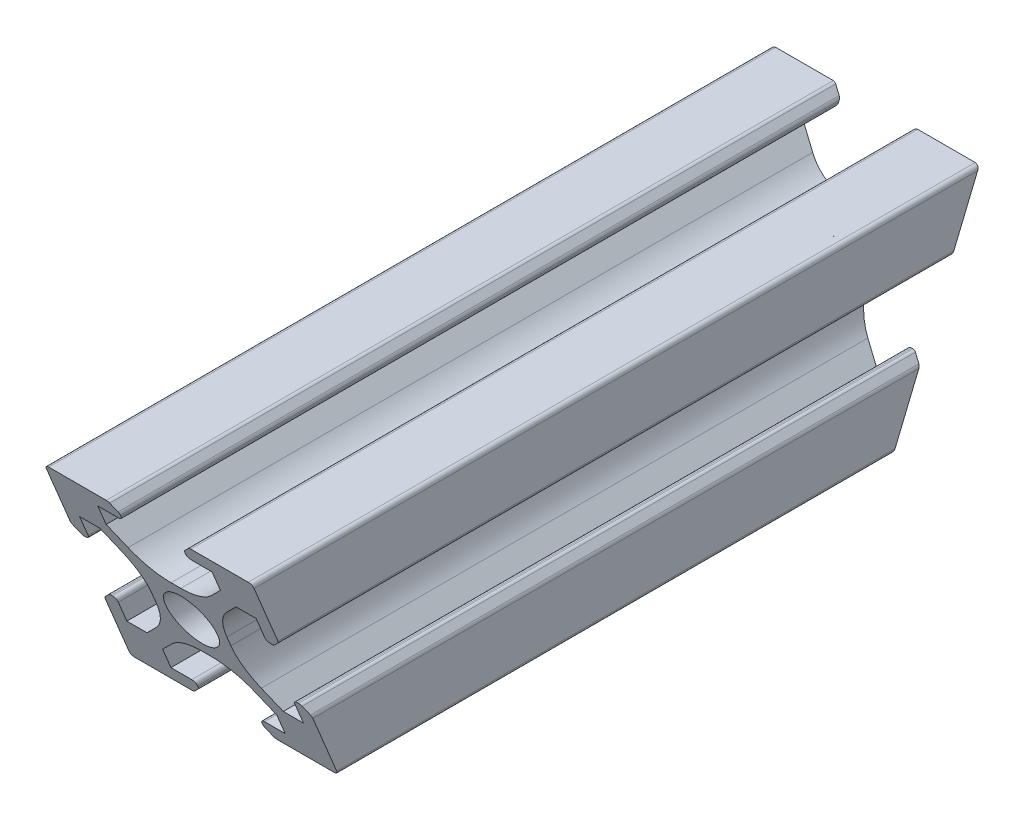
from build123d import *

# Parameters (mm, degrees)
RESSALTO_EXTRUS_O1_DEPTH = 70
PADR_OCIRCULAR1_COUNT    = 4
FILETE1_R                = 0.4
CUT_EXTRUDE1_DEPTH       = 74.484692283
SKETCH2_R                = 1.5
CUT_EXTRUDE2_DEPTH       = 74.484692283


with BuildPart() as part:
    # Esboço1 → Ressalto-extrusão1 (new body)
    with BuildSketch(Plane.XY):
        with BuildLine():
            ThreePointArc((-9.317157288, 3.217157288), (-9.187387948, 3.130448187), (-9.034314575, 3.1))
            Line((-9.034314575, 3.1), (-8.9, 3.1))
            ThreePointArc((-8.9, 3.1), (-8.617157288, 3.217157288), (-8.5, 3.5))
            Line((-8.5, 3.5), (-8.5, 5.5))
            Line((-8.5, 5.5), (-6.560660172, 5.5))
            Line((-6.560660172, 5.5), (-5.064466094, 4.003805922))
            ThreePointArc((-5.064466094, 4.003805922), (-3.980602337, 2.381689178), (-3.6, 0.468272016))
            Line((-3.6, 0.468272016), (-3.6, 0))
            Line((-3.6, 0), (-2.5, 0))
            ThreePointArc((-2.5, 0), (-1.767766953, 1.767766953), (0, 2.5))
            Line((0, 2.5), (0, 3.6))
            Line((0, 3.6), (-0.468272016, 3.6))
            ThreePointArc((-0.468272016, 3.6), (-2.381689178, 3.980602337), (-4.003805922, 5.064466094))
            Line((-4.003805922, 5.064466094), (-5.5, 6.560660172))
            Line((-5.5, 6.560660172), (-5.5, 8.5))
            Line((-5.5, 8.5), (-3.5, 8.5))
            ThreePointArc((-3.5, 8.5), (-3.217157288, 8.617157288), (-3.1, 8.9))
            Line((-3.1, 8.9), (-3.1, 9.034314575))
            ThreePointArc((-3.1, 9.034314575), (-3.130448187, 9.187387948), (-3.217157288, 9.317157288))
            Line((-3.217157288, 9.317157288), (-3.782842712, 9.882842712))
            ThreePointArc((-3.782842712, 9.882842712), (-3.912612052, 9.969551813), (-4.065685425, 10))
            Line((-4.065685425, 10), (-10, 10))
            Line((-10, 10), (-10, 4.065685425))
            ThreePointArc((-10, 4.065685425), (-9.969551813, 3.912612052), (-9.882842712, 3.782842712))
            Line((-9.882842712, 3.782842712), (-9.317157288, 3.217157288))
        make_face()
    ressalto_extrus_o1 = extrude(amount=RESSALTO_EXTRUS_O1_DEPTH)

    # PadrãoCircular1: Ressalto-extrusão1 ×4 about axis
    padr_ocircular1_axis = Axis((0, 0, 0), (0, 0, 1))
    for i in range(1, PADR_OCIRCULAR1_COUNT):
        add(ressalto_extrus_o1.rotate(padr_ocircular1_axis, i * 360 / PADR_OCIRCULAR1_COUNT))

    # Filete1
    filete1_edges = [part.edges().sort_by_distance(p)[0] for p in [
        (10, -10, 35),
        (10, 10, 35),
        (-10, 10, 35),
        (-10, -10, 35),
    ]]
    fillet(filete1_edges, radius=FILETE1_R)

    # Sketch1 → Cut-Extrude1 (cut, through all)
    with BuildSketch(Plane.ZY.offset(10)):
        Polygon((2.45807358, 4.065685425), (0, 4.065685425), (0, -10), (8.284271247, -10), align=None)
        Polygon((0.165685425, 9.6), (0, 9.6), (0, 4.065685425), (2.45807358, 4.065685425), align=None)
        Polygon((70, 9.6), (69.834314575, 9.6), (67.54192642, 4.065685425), (70, 4.065685425), align=None)
        Polygon((70, 4.065685425), (67.54192642, 4.065685425), (61.715728753, -10), (70, -10), (70, -9.6), align=None)
        Polygon((70, 10), (69.834314575, 9.6), (70, 9.6), align=None)
        Polygon((0.165685425, 9.6), (0, 10), (0, 9.6), align=None)
    extrude(amount=-CUT_EXTRUDE1_DEPTH, mode=Mode.SUBTRACT)

    # Sketch2 → Cut-Extrude2 (cut, through all)
    with BuildSketch(Plane.ZY.offset(10)):
        with Locations(Location((11, 0, 0), (0, 0, 270))):
            Circle(SKETCH2_R)
        with Locations(Location((59, 0, 0), (0, 0, 270))):
            Circle(SKETCH2_R)
    extrude(amount=-CUT_EXTRUDE2_DEPTH, mode=Mode.SUBTRACT)


solid = part.part
